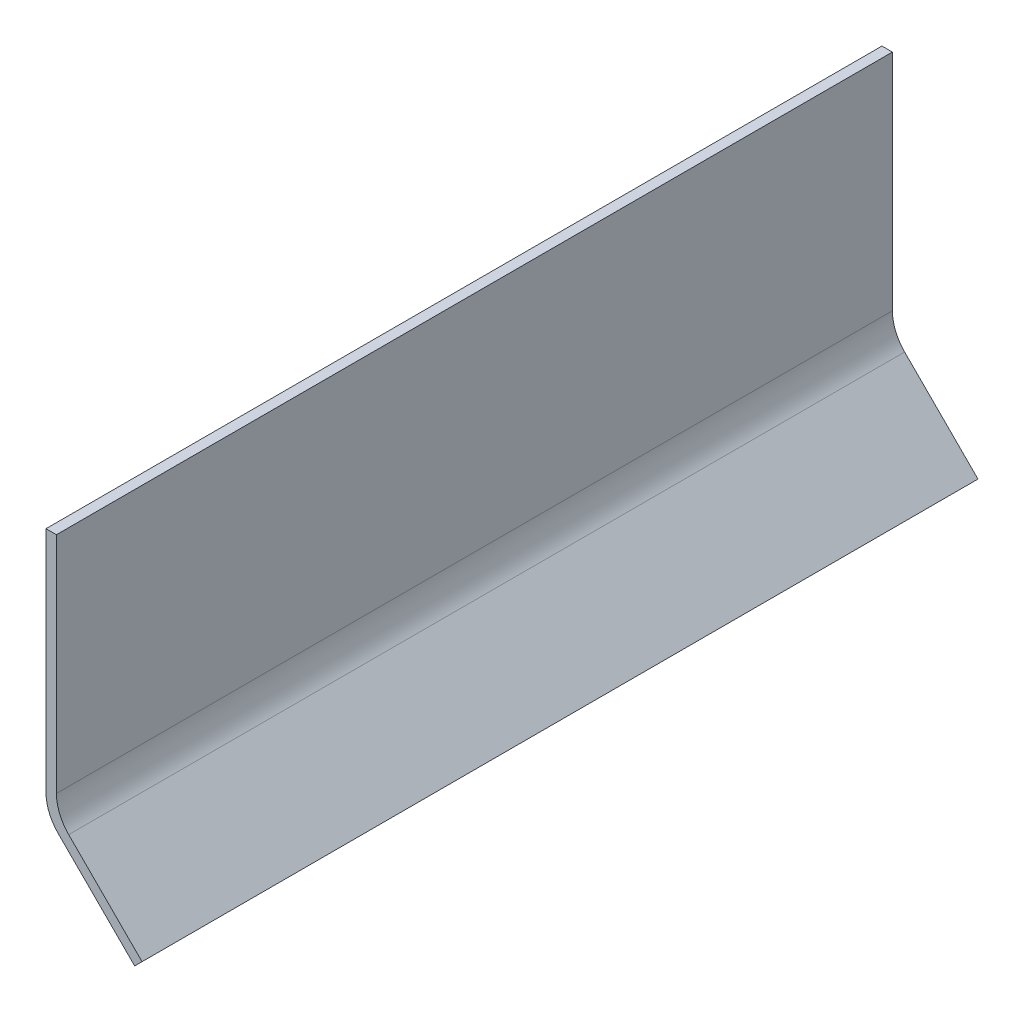
from build123d import *

# Parameters (mm, degrees)
BOSS_EXTRUDE1_DEPTH = 63.5


with BuildPart() as part:
    # Sketch1 → Boss-Extrude1 (new, symmetric)
    with BuildSketch(Plane.XY):
        with BuildLine():
            Line((0, 16.100640303), (0, 50.8))
            Line((0, 50.8), (1.5875, 50.8))
            Line((1.5875, 50.8), (1.5875, 16.758204333))
            ThreePointArc((1.5875, 16.758204333), (2.070864969, 14.328164537), (3.447371939, 12.268076272))
            Line((3.447371939, 12.268076272), (14.592916197, 1.122532015))
            Line((14.592916197, 1.122532015), (13.470384182, 0))
            Line((13.470384182, 0), (1.859871939, 11.610512242))
            ThreePointArc((1.859871939, 11.610512242), (0.483364969, 13.670600507), (0, 16.100640303))
        make_face()
    extrude(amount=BOSS_EXTRUDE1_DEPTH, both=True)


solid = part.part
